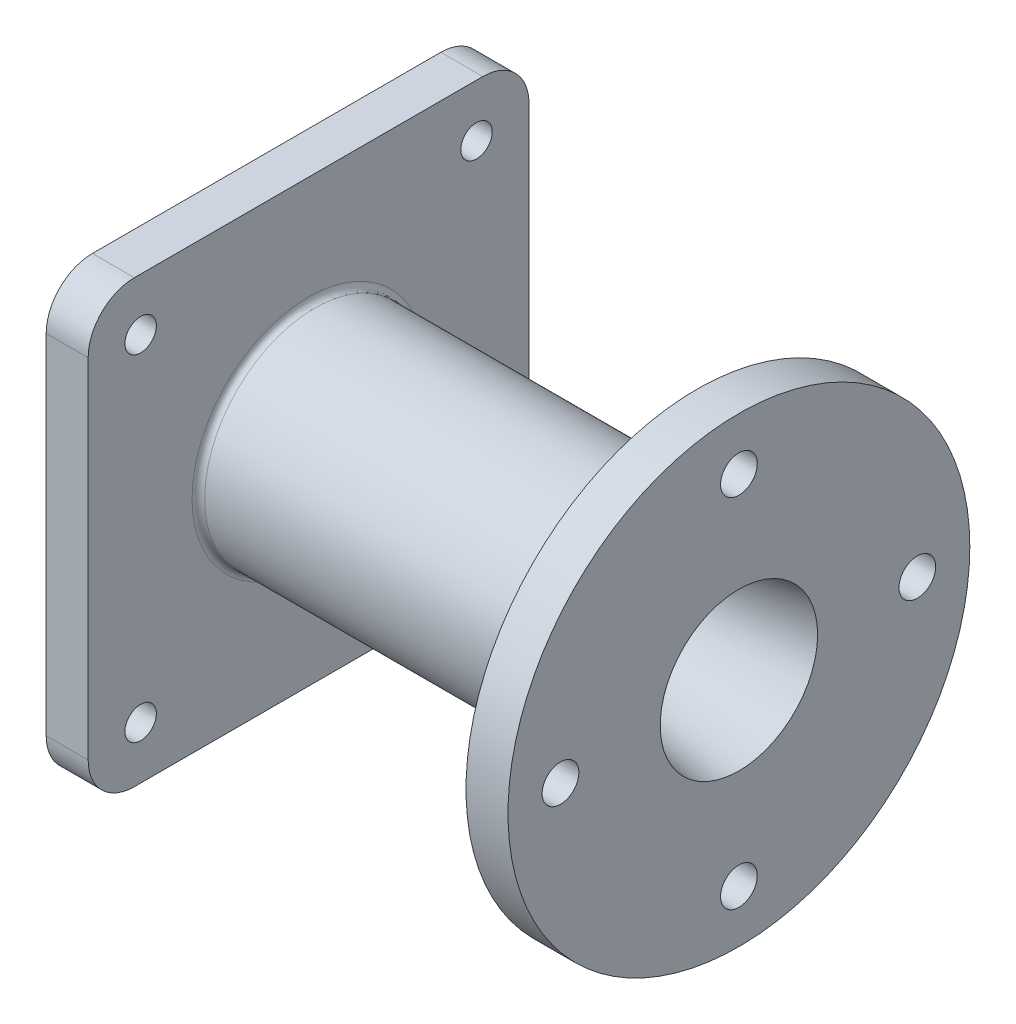
from build123d import *

# Parameters (mm, degrees)
CUT_EXTRUDE_1_REACH      = 275.542
SKETCH_2_R               = 8.75
PATTERN_CIRCULAR_1_COUNT = 4
EXTRUDE_START            = -20
SKETCH_3_W               = 210
SKETCH_3_H               = 210
SKETCH_3_R               = 28.7125
EXTRUDE_1_DEPTH          = 20
SKETCH_4_R               = 7.5
CUT_EXTRUDE_2_DEPTH      = 20
FILLET_1_R               = 22
PATTERN_CIRCULAR_5_COUNT = 4
FILLET_2_R               = 3
SKETCH_5_R               = 28.7125
SKETCH_5_R_2             = 27.5
EXTRUDE_2_DEPTH          = 17.5
FILLET_3_R               = 3


with BuildPart() as part:
    # Эскиз1 → Повернуть1 (revolve)
    with BuildSketch(Plane.XY, mode=Mode.PRIVATE) as revolve_1_sk:
        Polygon((0, 37.5), (0, 110), (-20, 110), (-20, 60), (-55, 52.5), (-205, 52.5), (-205, 105), (-225, 105), (-225, 62.5), (-210, 62.5), (-210, 28.7125), (-160, 28.7125), (-160, 40), (-95, 40), (-95, 28.7125), (-77.5, 28.7125), (-77.5, 25), align=None)
    revolve(revolve_1_sk.sketch.rotate(Axis((0, 0, 0), (-1, 0, 0)), 90), axis=Axis((0, 0, 0), (-1, 0, 0)))

    # Эскиз2 → Вырез-Вытянуть1 (cut, up to next)
    with BuildSketch(Plane(origin=(0, 0, 0), x_dir=(0, 0, -1), z_dir=(1, 0, 0)), mode=Mode.PRIVATE) as cut_extrude_1_sk1:
        with Locations((0, 85)):
            Circle(SKETCH_2_R)
    cut_extrude_1_tool1 = extrude(cut_extrude_1_sk1.sketch, amount=-CUT_EXTRUDE_1_REACH, mode=Mode.PRIVATE) & part.part
    cut_extrude_1 = cut_extrude_1_tool1.solids().sort_by_distance((0, 85, 0))[0]
    add(cut_extrude_1, mode=Mode.SUBTRACT)

    # Круговой массив1: Вырез-Вытянуть1 ×4 about axis
    pattern_circular_1_axis = Axis((0, 0, 0), (1, 0, 0))
    for i in range(1, PATTERN_CIRCULAR_1_COUNT):
        add(cut_extrude_1.rotate(pattern_circular_1_axis, i * 360 / PATTERN_CIRCULAR_1_COUNT), mode=Mode.SUBTRACT)

    # Эскиз3 → Бобышка-Вытянуть1 (add)
    with BuildSketch(Plane.ZY.offset(225).offset(EXTRUDE_START)):
        Rectangle(SKETCH_3_W, SKETCH_3_H)
        with Locations(Location((0, 0, 0), (0, 0, 180))):
            Circle(SKETCH_3_R, mode=Mode.SUBTRACT)
    extrude(amount=EXTRUDE_1_DEPTH)

    # Эскиз4 → Вырез-Вытянуть2 (cut)
    with BuildSketch(Plane.ZY.offset(225)):
        with Locations((80, 80)):
            Circle(SKETCH_4_R)
    cut_extrude_2 = extrude(amount=-CUT_EXTRUDE_2_DEPTH, mode=Mode.SUBTRACT)

    # Скругление1
    fillet_1_edges = [part.edges().sort_by_distance(p)[0] for p in [
        (-215, 105, 105),
        (-215, -105, 105),
        (-215, -105, -105),
        (-215, 105, -105),
    ]]
    fillet(fillet_1_edges, radius=FILLET_1_R)

    # Круговой массив5: Вырез-Вытянуть2 ×4 about axis
    pattern_circular_5_axis = Axis((0, 0, 0), (1, 0, 0))
    for i in range(1, PATTERN_CIRCULAR_5_COUNT):
        add(cut_extrude_2.rotate(pattern_circular_5_axis, i * 360 / PATTERN_CIRCULAR_5_COUNT), mode=Mode.SUBTRACT)

    # Скругление2
    fillet_2_edges = [part.edges().sort_by_distance(p)[0] for p in [
        (-160, 0, 40),
        (-95, 0, 40),
    ]]
    fillet(fillet_2_edges, radius=FILLET_2_R)

    # Эскиз5 → Бобышка-Вытянуть2 (add)
    with BuildSketch(Plane.ZY.offset(77.5)):
        with Locations(Location((0, 0, 0), (0, 0, 180))):
            Circle(SKETCH_5_R)
        with Locations(Location((0, 0, 0), (0, 0, 180))):
            Circle(SKETCH_5_R_2, mode=Mode.SUBTRACT)
    extrude(amount=EXTRUDE_2_DEPTH)

    # Скругление3
    fillet_3_edges = [part.edges().sort_by_distance(p)[0] for p in [
        (-20, 0, 60),
        (-205, 0, 52.5),
    ]]
    fillet(fillet_3_edges, radius=FILLET_3_R)


solid = part.part
